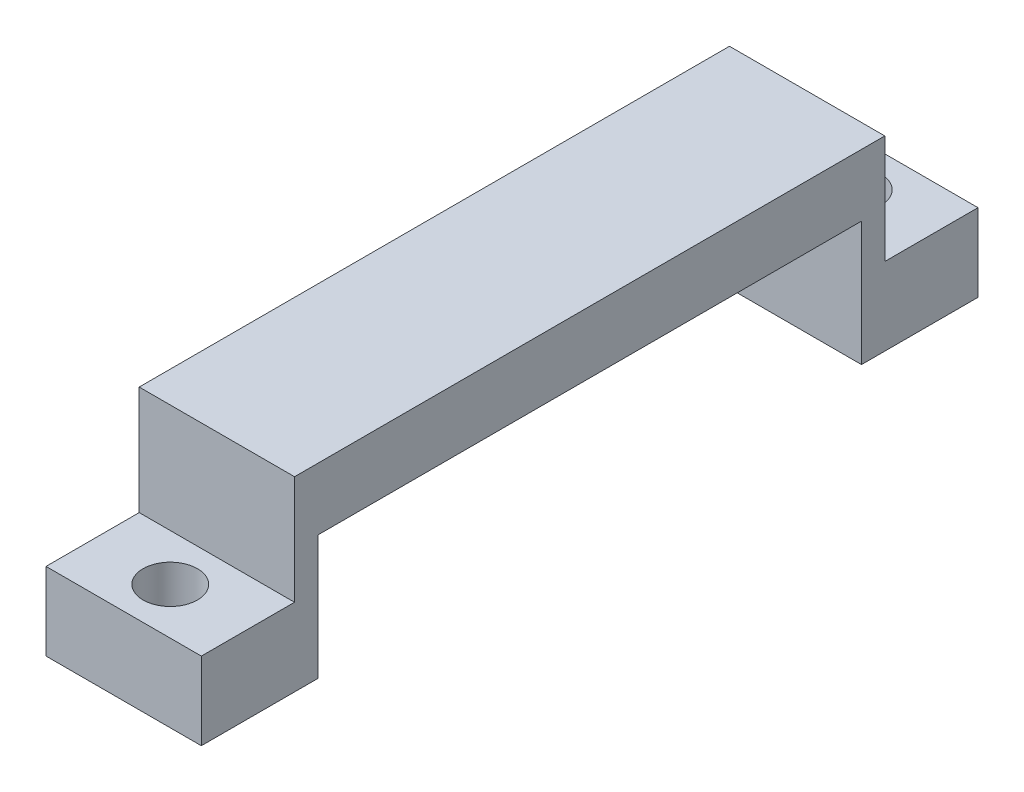
from build123d import *

# Parameters (mm, degrees)
CROQUIS1_W              = 40
CROQUIS1_H              = 50
SALIENTE_EXTRUIR1_DEPTH = 12
CROQUIS2_W              = 35
CROQUIS2_H              = 8
CORTAR_EXTRUIR1_DEPTH   = 65
CROQUIS3_W              = 30
CROQUIS3_H              = 50
CORTAR_EXTRUIR2_DEPTH   = 65
CROQUIS4_W              = 10
CROQUIS4_H              = 6
CORTAR_EXTRUIR3_DEPTH   = 7
CROQUIS5_R              = 1.75
CORTAR_EXTRUIR4_DEPTH   = 7


with BuildPart() as part:
    # Croquis1 → Saliente-Extruir1 (new body)
    with BuildSketch(Plane(origin=(0, 0, 0), x_dir=(1, 0, 0), z_dir=(0, 1, 0))):
        Rectangle(CROQUIS1_W, CROQUIS1_H)
    extrude(amount=SALIENTE_EXTRUIR1_DEPTH)

    # Croquis2 → Cortar-Extruir1 (cut)
    with BuildSketch(Plane(origin=(20, 0, 0), x_dir=(0, 0, -1), z_dir=(1, 0, 0))):
        with Locations((0, 4)):
            Rectangle(CROQUIS2_W, CROQUIS2_H)
    extrude(amount=-CORTAR_EXTRUIR1_DEPTH, mode=Mode.SUBTRACT)

    # Croquis3 → Cortar-Extruir2 (cut)
    with BuildSketch(Plane(origin=(0, 12, 0), x_dir=(1, 0, 0), z_dir=(0, 1, 0))):
        with Locations((-5, 0)):
            Rectangle(CROQUIS3_W, CROQUIS3_H)
    extrude(amount=-CORTAR_EXTRUIR2_DEPTH, mode=Mode.SUBTRACT)

    # Croquis4 → Cortar-Extruir3 (cut)
    with BuildSketch(Plane(origin=(0, 12, 0), x_dir=(1, 0, 0), z_dir=(0, 1, 0))):
        with Locations((15, 22)):
            Rectangle(CROQUIS4_W, CROQUIS4_H)
    cortar_extruir3 = extrude(amount=-CORTAR_EXTRUIR3_DEPTH, mode=Mode.SUBTRACT)

    # Simetría1: Cortar-Extruir3 across plane
    add(cortar_extruir3.mirror(Plane.XY), mode=Mode.SUBTRACT)

    # Croquis5 → Cortar-Extruir4 (cut)
    with BuildSketch(Plane(origin=(0, 5, 0), x_dir=(1, 0, 0), z_dir=(0, 1, 0))):
        with Locations(Location((15, 22, 0), (0, 0, 270))):
            Circle(CROQUIS5_R)
    cortar_extruir4 = extrude(amount=-CORTAR_EXTRUIR4_DEPTH, mode=Mode.SUBTRACT)

    # Simetría2: Cortar-Extruir4 across plane
    add(cortar_extruir4.mirror(Plane.XY), mode=Mode.SUBTRACT)


solid = part.part
